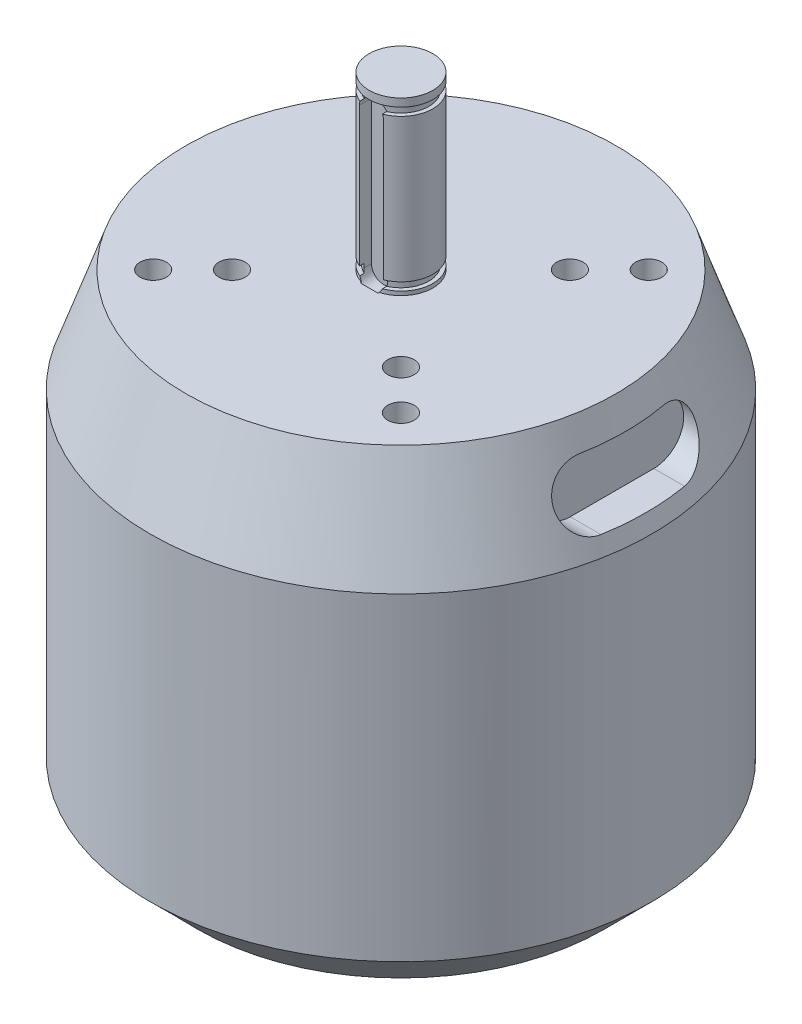
from build123d import *

# Parameters (mm, degrees)
M4X0_7_1_D          = 3.3
M4X0_7_1_DEPTH      = 11.5
M4X0_7_1_TIP        = 0.991420021
CUT_EXTRUDE1_DEPTH  = 1.8
CHAMFER_1_SIZE      = 4.5
CHAMFER_1_SIZE2     = 13
CHAMFER_2_SIZE      = 6
SKETCH_6_R          = 7.5
EXTRUDE_1_DEPTH     = 2
SKETCH_7_W          = 0.5
SKETCH_7_H          = 1
CUT_EXTRUDE_START   = 31.5
CUT_EXTRUDE_1_DEPTH = 5


with BuildPart() as part:
    # 스케치1 → 회전1 (revolve)
    with BuildSketch(Plane.XY, mode=Mode.PRIVATE) as revolve_1_sk:
        Polygon((0, 80.5), (4, 80.5), (4, 59), (31.5, 59), (31.5, 0), (0, 0), align=None)
    revolve(revolve_1_sk.sketch.rotate(Axis((0, 0, 0), (0, 1, 0)), 90), axis=Axis((0, 0, 0), (0, 1, 0)))

    # M4x0.7 나사 구멍1
    with Locations(Plane(origin=(0, 59, 0), x_dir=(1, 0, 0), z_dir=(0, 1, 0))):
        with Locations((10.606601718, 10.606601718), (15.556349186, 15.556349186), (10.606601718, -10.606601718), (15.556349186, -15.556349186), (-10.606601718, -10.606601718), (-15.556349186, -15.556349186), (-10.606601718, 10.606601718), (-15.556349186, 15.556349186)):
            Hole(M4X0_7_1_D / 2, depth=M4X0_7_1_DEPTH)
            with Locations((0, 0, -(M4X0_7_1_DEPTH + M4X0_7_1_TIP / 2))):  # 118° drill point
                Cone(0, M4X0_7_1_D / 2, M4X0_7_1_TIP, mode=Mode.SUBTRACT)

    # Sketch3 → Cut-Extrude1 (cut)
    with BuildSketch(Plane(origin=(2.845698698, 80.5, 4), x_dir=(0, 1, 0), z_dir=(0, 0, -1))):
        with BuildLine():
            Line((-2.5, -1.345698698), (-20.5, -1.345698698))
            ThreePointArc((-20.5, -1.345698698), (-22, -2.845698698), (-20.5, -4.345698698))
            Line((-20.5, -4.345698698), (-2.5, -4.345698698))
            ThreePointArc((-2.5, -4.345698698), (-1, -2.845698698), (-2.5, -1.345698698))
        make_face()
    extrude(amount=CUT_EXTRUDE1_DEPTH, mode=Mode.SUBTRACT)

    # 모따기1
    chamfer_1_edges = [part.edges().sort_by_distance(p)[0] for p in [
        (0, 59, 31.5),
    ]]
    chamfer_1_side = [part.faces().sort_by_distance(p)[0] for p in [
        (0, 59, 30.609045456),
    ]]
    chamfer(chamfer_1_edges, length=CHAMFER_1_SIZE, length2=CHAMFER_1_SIZE2, reference=chamfer_1_side[0])

    # 모따기2
    chamfer_2_edges = [part.edges().sort_by_distance(p)[0] for p in [
        (0, 0, 31.5),
    ]]
    chamfer(chamfer_2_edges, length=CHAMFER_2_SIZE)

    # 스케치6 → 보스-돌출1 (add)
    with BuildSketch(Plane.XZ):
        with Locations(Location((0, 0, 0), (0, 0, 270))):
            Circle(SKETCH_6_R)
    extrude(amount=EXTRUDE_1_DEPTH)

    # 스케치7 → 컷-회전1 (revolve, cut)
    with BuildSketch(Plane(origin=(0, 0, 0), x_dir=(0, 0, -1), z_dir=(1, 0, 0))):
        with Locations((3.75, 79)):
            Rectangle(SKETCH_7_W, SKETCH_7_H)
        with Locations((3.75, 60)):
            Rectangle(SKETCH_7_W, SKETCH_7_H)
    revolve(axis=Axis((0, 0, 0), (0, 1, 0)), mode=Mode.SUBTRACT)

    # 스케치9 → 컷-돌출1 (cut)
    with BuildSketch(Plane(origin=(0, 0, 0), x_dir=(0, 0, -1), z_dir=(1, 0, 0)).offset(CUT_EXTRUDE_START)):
        with BuildLine():
            Line((5.25, 48), (-5.25, 48))
            ThreePointArc((-5.25, 48), (-9, 51.75), (-5.25, 55.5))
            Line((-5.25, 55.5), (5.25, 55.5))
            ThreePointArc((5.25, 55.5), (9, 51.75), (5.25, 48))
        make_face()
    extrude(amount=-CUT_EXTRUDE_1_DEPTH, mode=Mode.SUBTRACT)


solid = part.part
